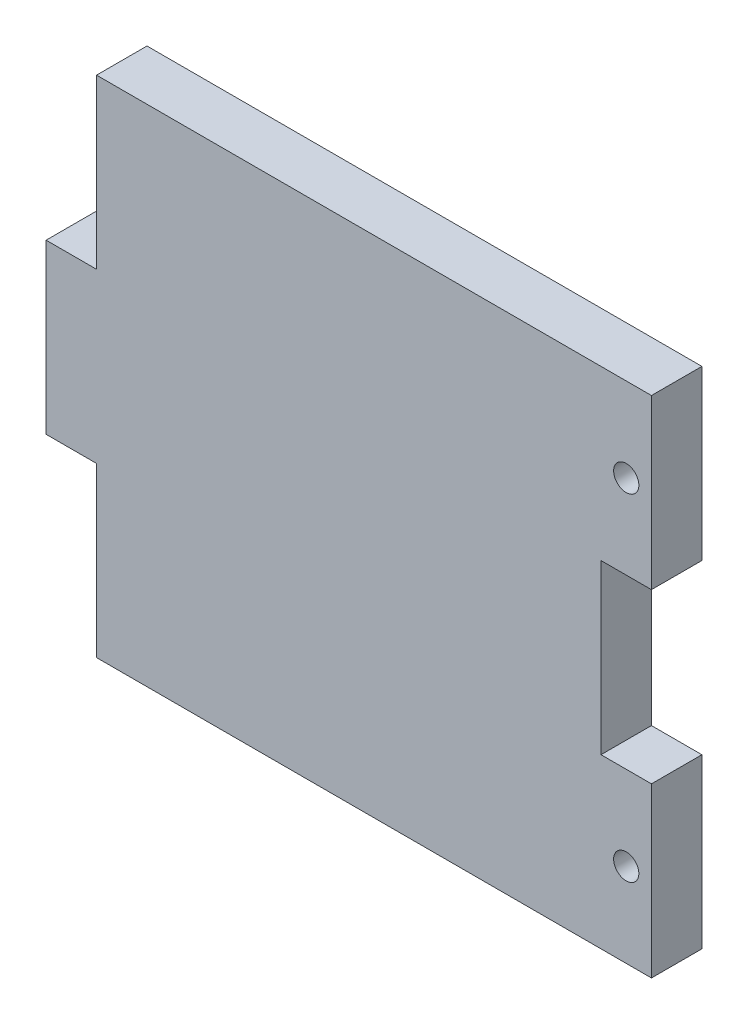
from build123d import *

# Parameters (mm, degrees)
BOSS_EXTRU_1_DEPTH      = 6
ESQUISSE2_R             = 1.5
ENL_V_MAT_EXTRU_1_DEPTH = 94.914855055


with BuildPart() as part:
    # Esquisse1 → Boss.-Extru.1 (new body)
    with BuildSketch(Plane.XY):
        Polygon((0, 0), (-66, 0), (-66, 20), (-72, 20), (-72, 40), (-66, 40), (-66, 60), (0, 60), (0, 40), (-6, 40), (-6, 20), (0, 20), align=None)
    extrude(amount=BOSS_EXTRU_1_DEPTH)

    # Esquisse2 → Enlèv. mat.-Extru.1 (cut, through all)
    with BuildSketch(Plane(origin=(0, 0, 0), x_dir=(-1, 0, 0), z_dir=(0, 0, -1))):
        with Locations(Location((3, 50, 0), (0, 0, 180))):
            Circle(ESQUISSE2_R)
        with Locations((3, 10)):
            Circle(ESQUISSE2_R)
    extrude(amount=-ENL_V_MAT_EXTRU_1_DEPTH, mode=Mode.SUBTRACT)


solid = part.part
